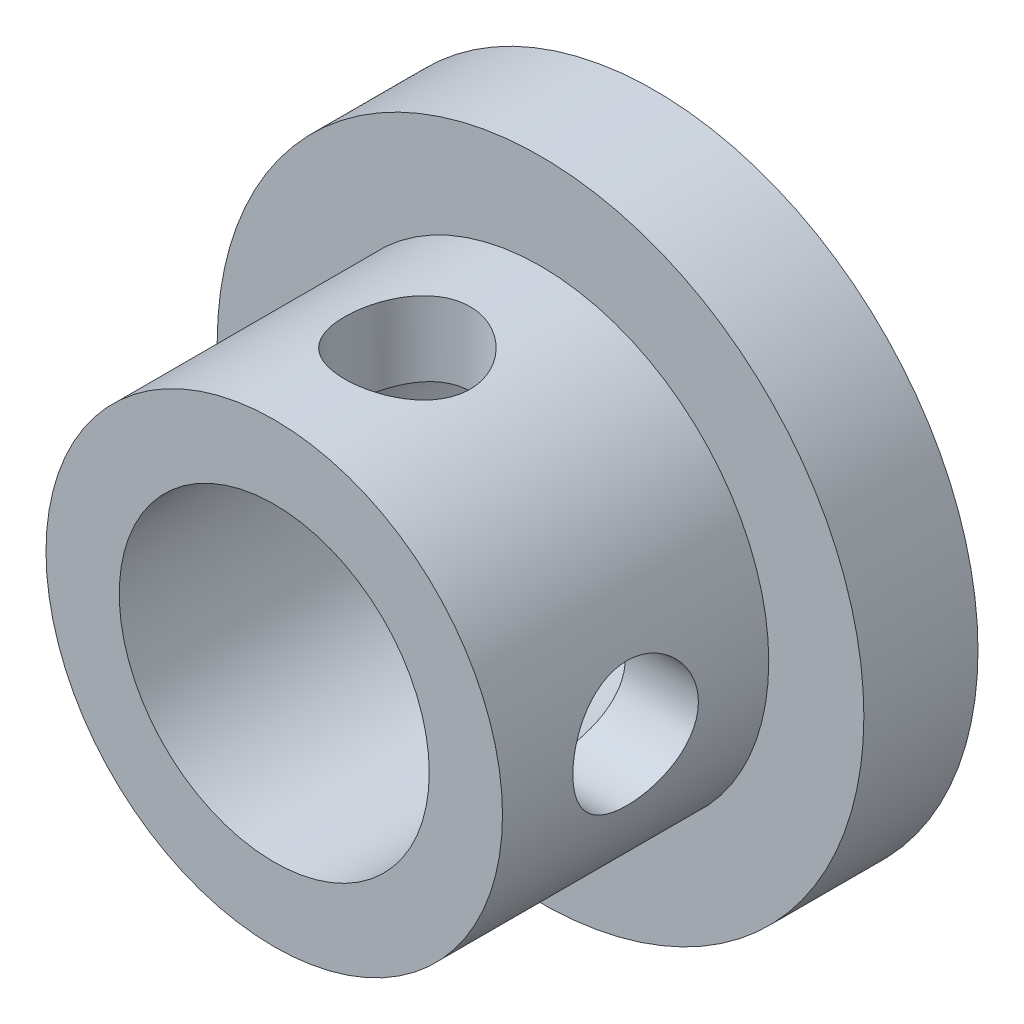
from build123d import *

# Parameters (mm, degrees)
SKETCH_2_R                       = 8.5
EXTRUDE_2_DEPTH                  = 3
SKETCH_3_R                       = 6
EXTRUDE_3_DEPTH                  = 7
SKETCH_4_R                       = 4.075
CUT_EXTRUDE_1_DEPTH              = 16.636495771
HOLE_WIZARD_M4_3_REACH           = 20.021
HOLE_WIZARD_M4_3_BORE_R          = 1.65
HOLE_WIZARD_M4_3_ON_FACE_2_REACH = 20.021
HOLE_WIZARD_M4_3_BORE_2_R        = 1.65


with BuildPart() as part:
    # 스케치2 → 보스-돌출2 (new body)
    with BuildSketch(Plane.XY):
        Circle(SKETCH_2_R)
    extrude(amount=EXTRUDE_2_DEPTH)

    # 스케치3 → 보스-돌출3 (add)
    with BuildSketch(Plane.XY.offset(3)):
        Circle(SKETCH_3_R)
    extrude(amount=EXTRUDE_3_DEPTH)

    # 스케치4 → 컷-돌출1 (cut, through all)
    with BuildSketch(Plane.XY.offset(10)):
        Circle(SKETCH_4_R)
    extrude(amount=-CUT_EXTRUDE_1_DEPTH, mode=Mode.SUBTRACT)

    # M4 나사 구멍3 bore (on position points) → M4 나사 구멍3 (cut, up to next)
    with BuildSketch(Plane(origin=(0, 6, 6.5), x_dir=(1, 0, 0), z_dir=(0, 1, 0)), mode=Mode.PRIVATE) as hole_wizard_m4_3_sk1:
        Circle(HOLE_WIZARD_M4_3_BORE_R)
    hole_wizard_m4_3_tool1 = extrude(hole_wizard_m4_3_sk1.sketch, amount=-HOLE_WIZARD_M4_3_REACH, mode=Mode.PRIVATE) & part.part
    add(hole_wizard_m4_3_tool1.solids().sort_by_distance((0, 6, 6.5))[0], mode=Mode.SUBTRACT)

    # M4 나사 구멍3 bore 2 (on position points) → M4 나사 구멍3 on face 2 (cut, up to next)
    with BuildSketch(Plane(origin=(6, 0, 6.5), x_dir=(0, 0, 1), z_dir=(1, 0, 0)), mode=Mode.PRIVATE) as hole_wizard_m4_3_on_face_2_sk1:
        Circle(HOLE_WIZARD_M4_3_BORE_2_R)
    hole_wizard_m4_3_on_face_2_tool1 = extrude(hole_wizard_m4_3_on_face_2_sk1.sketch, amount=-HOLE_WIZARD_M4_3_ON_FACE_2_REACH, mode=Mode.PRIVATE) & part.part
    add(hole_wizard_m4_3_on_face_2_tool1.solids().sort_by_distance((6, 0, 6.5))[0], mode=Mode.SUBTRACT)


solid = part.part
